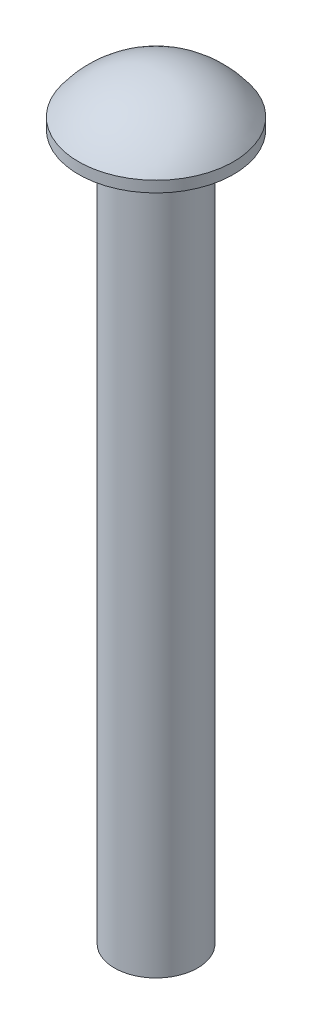
from build123d import *


with BuildPart() as part:
    # Sketch1 → Revolve1 (revolve)
    with BuildSketch(Plane.XY, mode=Mode.PRIVATE) as revolve1_sk:
        with BuildLine():
            Line((0, 0), (-1.5, 0))
            Line((-1.5, 0), (-1.5, 25.4))
            Line((-1.5, 25.4), (-2.794, 25.4))
            Line((-2.794, 25.4), (-2.794, 25.796875))
            ThreePointArc((-2.794, 25.796875), (-1.572222967, 26.857544348), (0, 27.239478281))
            Line((0, 27.239478281), (0, 0))
        make_face()
    revolve(revolve1_sk.sketch.rotate(Axis((0, 0, 0), (0, 1, 0)), 270), axis=Axis((0, 0, 0), (0, 1, 0)))


solid = part.part
